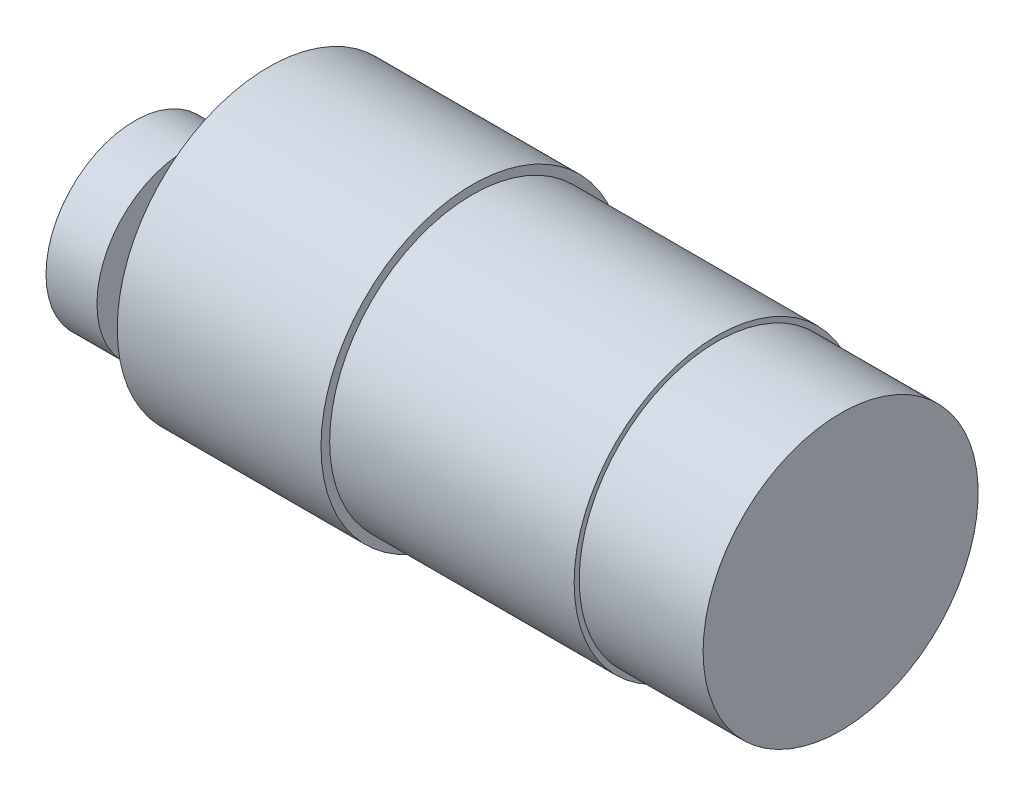
from build123d import *

# Parameters (mm, degrees)
ESQUISSE6_R                                   = 18.8595
BOSS_EXTRU_2_DEPTH                            = 25.4
ESQUISSE7_R                                   = 17.78
BOSS_EXTRU_3_DEPTH                            = 30.48
ESQUISSE8_R                                   = 17.145
BOSS_EXTRU_4_DEPTH                            = 15.4432
ESQUISSE9_R                                   = 5.969
BOSS_EXTRU_5_DEPTH                            = 6.096
ESQUISSE10_R                                  = 4.699
BOSS_EXTRU_6_DEPTH                            = 4.233333333
ESQUISSE11_R                                  = 11.0617
BOSS_EXTRU_7_DEPTH                            = 6.35
ESQUISSE12_R                                  = 4.7752
BOSS_EXTRU_8_DEPTH                            = 3.302
PER_AGE_POUR_TUYAU_POUR_TROU_TARAUD_1_1_D     = 6.1468
PER_AGE_POUR_TUYAU_POUR_TROU_TARAUD_1_1_DEPTH = 19.981333333
BOSS_EXTRU_9_DEPTH                            = 19.981333333
BOSS_EXTRU_10_DEPTH                           = 2.032
ENL_V_MAT_EXTRU_2_REACH                       = 93.955
ESQUISSE18_R                                  = 1.4605
ESQUISSE19_R                                  = 1.5
ESQUISSE19_R_2                                = 1.500000048
ENL_V_MAT_EXTRU_3_DEPTH                       = 5


with BuildPart() as part:
    # Esquisse6 → Boss.-Extru.2 (new body)
    with BuildSketch(Plane(origin=(0, 0, 0), x_dir=(0, 0, -1), z_dir=(1, 0, 0))):
        Circle(ESQUISSE6_R)
    extrude(amount=BOSS_EXTRU_2_DEPTH)

    # Esquisse7 → Boss.-Extru.3 (add)
    with BuildSketch(Plane(origin=(25.4, 0, 0), x_dir=(0, 0, -1), z_dir=(1, 0, 0))):
        with Locations(Location((0, 0, 0), (0, 0, 180))):
            Circle(ESQUISSE7_R)
    extrude(amount=BOSS_EXTRU_3_DEPTH)

    # Esquisse8 → Boss.-Extru.4 (add)
    with BuildSketch(Plane(origin=(55.88, 0, 0), x_dir=(0, 0, -1), z_dir=(1, 0, 0))):
        with Locations(Location((0, 0, 0), (0, 0, 180))):
            Circle(ESQUISSE8_R)
    extrude(amount=BOSS_EXTRU_4_DEPTH)

    # Esquisse9 → Boss.-Extru.5 (add)
    with BuildSketch(Plane.ZY):
        with Locations(Location((0, -6.35, 0), (0, 0, 180))):
            Circle(ESQUISSE9_R)
    extrude(amount=BOSS_EXTRU_5_DEPTH)

    # Esquisse10 → Boss.-Extru.6 (add)
    with BuildSketch(Plane.ZY.offset(6.096)):
        with Locations((0, -6.35)):
            Circle(ESQUISSE10_R)
    extrude(amount=BOSS_EXTRU_6_DEPTH)

    # Esquisse11 → Boss.-Extru.7 (add)
    with BuildSketch(Plane.ZY.offset(10.329333333)):
        with Locations((0, -6.35)):
            Circle(ESQUISSE11_R)
    extrude(amount=BOSS_EXTRU_7_DEPTH)

    # Esquisse12 → Boss.-Extru.8 (add)
    with BuildSketch(Plane.ZY.offset(16.679333333)):
        with Locations(Location((0, -6.35, 0), (0, 0, 180))):
            Circle(ESQUISSE12_R)
    extrude(amount=BOSS_EXTRU_8_DEPTH)

    # Perçage pour tuyau pour trou taraudé 1/161
    with Locations(Plane.ZY.offset(19.981333333)):
        with Locations((0, -6.35)):
            Hole(PER_AGE_POUR_TUYAU_POUR_TROU_TARAUD_1_1_D / 2, depth=PER_AGE_POUR_TUYAU_POUR_TROU_TARAUD_1_1_DEPTH)

    # Esquisse16 → Boss.-Extru.9 (add)
    with BuildSketch(Plane.ZY):
        with BuildLine():
            Line((-1.778, -3.968758467), (1.778, -3.968758467))
            ThreePointArc((1.778, -3.968758467), (0, -9.3218), (-1.778, -3.968758467))
        make_face()
    extrude(amount=BOSS_EXTRU_9_DEPTH)

    # Esquisse17 → Boss.-Extru.10 (add)
    with BuildSketch(Plane.ZY.offset(19.981333333)):
        with BuildLine():
            Line((-1.778, -3.968758467), (1.778, -3.968758467))
            ThreePointArc((1.778, -3.968758467), (0, -9.3218), (-1.778, -3.968758467))
        make_face()
    extrude(amount=BOSS_EXTRU_10_DEPTH)

    # Esquisse18 → Enlèv. mat.-Extru.2 (cut, up to next)
    with BuildSketch(Plane.ZY.offset(16.679333333), mode=Mode.PRIVATE) as enl_v_mat_extru_2_sk1:
        with Locations((0, 0.254)):
            Circle(ESQUISSE18_R)
    enl_v_mat_extru_2_tool1 = extrude(enl_v_mat_extru_2_sk1.sketch, amount=-ENL_V_MAT_EXTRU_2_REACH, mode=Mode.PRIVATE) & part.part
    # Esquisse18 → Enlèv. mat.-Extru.2 (cut, up to next)
    with BuildSketch(Plane.ZY.offset(16.679333333), mode=Mode.PRIVATE) as enl_v_mat_extru_2_sk2:
        with Locations((6.604, -6.35)):
            Circle(ESQUISSE18_R)
    enl_v_mat_extru_2_tool2 = extrude(enl_v_mat_extru_2_sk2.sketch, amount=-ENL_V_MAT_EXTRU_2_REACH, mode=Mode.PRIVATE) & part.part
    # Esquisse18 → Enlèv. mat.-Extru.2 (cut, up to next)
    with BuildSketch(Plane.ZY.offset(16.679333333), mode=Mode.PRIVATE) as enl_v_mat_extru_2_sk3:
        with Locations((0, -12.954)):
            Circle(ESQUISSE18_R)
    enl_v_mat_extru_2_tool3 = extrude(enl_v_mat_extru_2_sk3.sketch, amount=-ENL_V_MAT_EXTRU_2_REACH, mode=Mode.PRIVATE) & part.part
    # Esquisse18 → Enlèv. mat.-Extru.2 (cut, up to next)
    with BuildSketch(Plane.ZY.offset(16.679333333), mode=Mode.PRIVATE) as enl_v_mat_extru_2_sk4:
        with Locations((-6.604, -6.35)):
            Circle(ESQUISSE18_R)
    enl_v_mat_extru_2_tool4 = extrude(enl_v_mat_extru_2_sk4.sketch, amount=-ENL_V_MAT_EXTRU_2_REACH, mode=Mode.PRIVATE) & part.part
    add(enl_v_mat_extru_2_tool1.solids().sort_by_distance((-16.679333, 0.254, 0))[0], mode=Mode.SUBTRACT)
    add(enl_v_mat_extru_2_tool2.solids().sort_by_distance((-16.679333, -6.35, 6.604))[0], mode=Mode.SUBTRACT)
    add(enl_v_mat_extru_2_tool3.solids().sort_by_distance((-16.679333, -12.954, 0))[0], mode=Mode.SUBTRACT)
    add(enl_v_mat_extru_2_tool4.solids().sort_by_distance((-16.679333, -6.35, -6.604))[0], mode=Mode.SUBTRACT)

    # Esquisse19 → Enlèv. mat.-Extru.3 (cut)
    with BuildSketch(Plane.ZY):
        with Locations((6.376248943, 14.789374018)):
            Circle(ESQUISSE19_R)
        with Locations((7.253318149, -15.510625982)):
            Circle(ESQUISSE19_R_2)
        with Locations((-16.809397398, 1.555003695)):
            Circle(ESQUISSE19_R_2)
    extrude(amount=-ENL_V_MAT_EXTRU_3_DEPTH, mode=Mode.SUBTRACT)


solid = part.part
